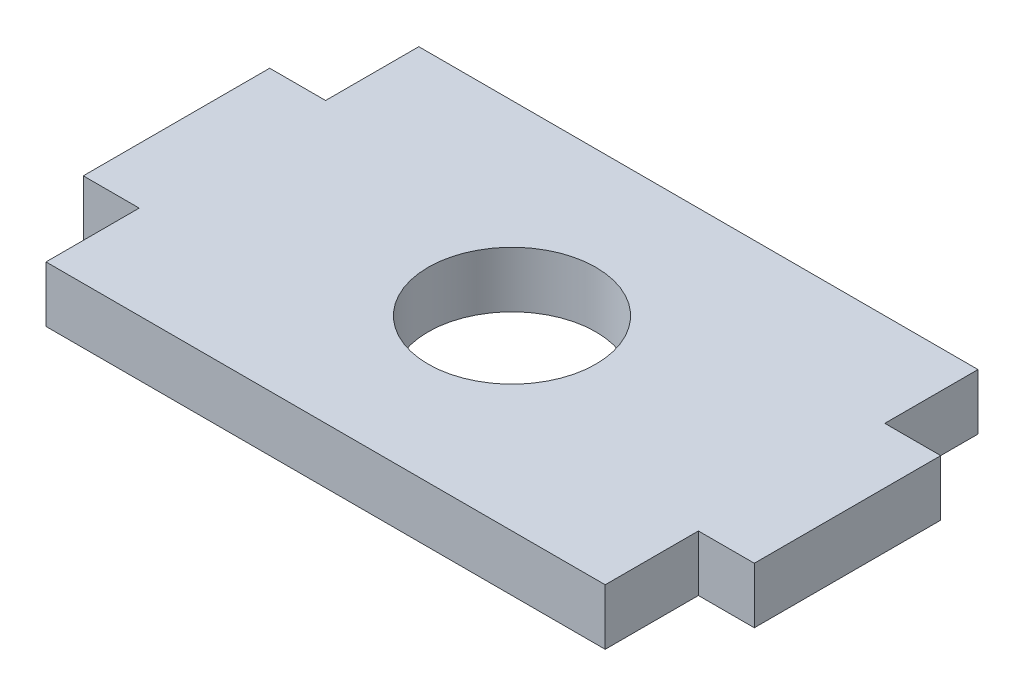
from build123d import *

# Parameters (mm, degrees)
CROQUIS1_R              = 4.5
SALIENTE_EXTRUIR1_DEPTH = 3


with BuildPart() as part:
    # Croquis1 → Saliente-Extruir1 (new body)
    with BuildSketch(Plane(origin=(0, 0, 0), x_dir=(1, 0, 0), z_dir=(0, 1, 0))):
        Polygon((0, -5), (0, 5), (3, 5), (3, 10), (33, 10), (33, 5), (36, 5), (36, -5), (33, -5), (33, -10), (3, -10), (3, -5), align=None)
        with Locations(Location((18, 0, 0), (0, 0, 270))):
            Circle(CROQUIS1_R, mode=Mode.SUBTRACT)
    extrude(amount=SALIENTE_EXTRUIR1_DEPTH)


solid = part.part
